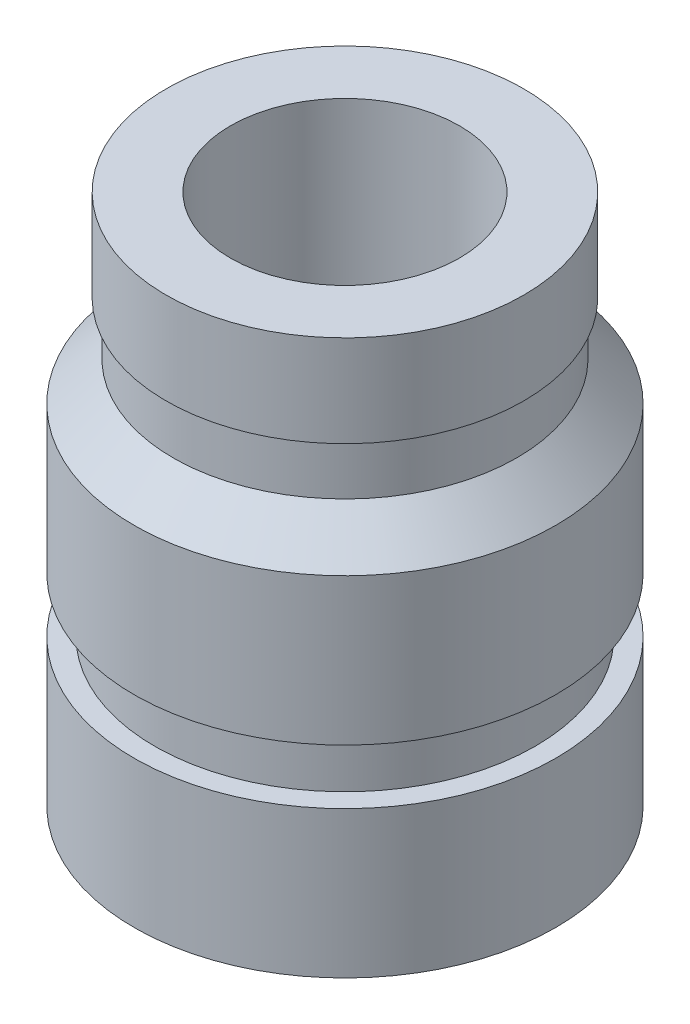
from build123d import *

# Parameters (mm, degrees)
SKETCH2_R          = 1.25
CUT_EXTRUDE1_DEPTH = 7.649812027


with BuildPart() as part:
    # Sketch1 → Revolve1 (revolve)
    with BuildSketch(Plane.XY, mode=Mode.PRIVATE) as revolve1_sk:
        Polygon((0, 0), (-2.3, 0), (-2.3, 1.6), (-2.075, 1.6), (-2.075, 2.2), (-2.3, 2.2), (-2.3, 3.8), (-1.875, 4.225), (-1.875, 4.8), (-1.95, 4.8), (-1.95, 5.8), (0, 5.8), align=None)
    revolve(revolve1_sk.sketch.rotate(Axis((0, -65.63361976, 0), (0, 1, 0)), 180), axis=Axis((0, -65.63361976, 0), (0, 1, 0)))

    # Sketch2 → Cut-Extrude1 (cut, through all)
    with BuildSketch(Plane(origin=(0, 5.8, 0), x_dir=(1, 0, 0), z_dir=(0, 1, 0))):
        with Locations(Location((0, 0, 0), (0, 0, 180))):
            Circle(SKETCH2_R)
    extrude(amount=-CUT_EXTRUDE1_DEPTH, mode=Mode.SUBTRACT)


solid = part.part
